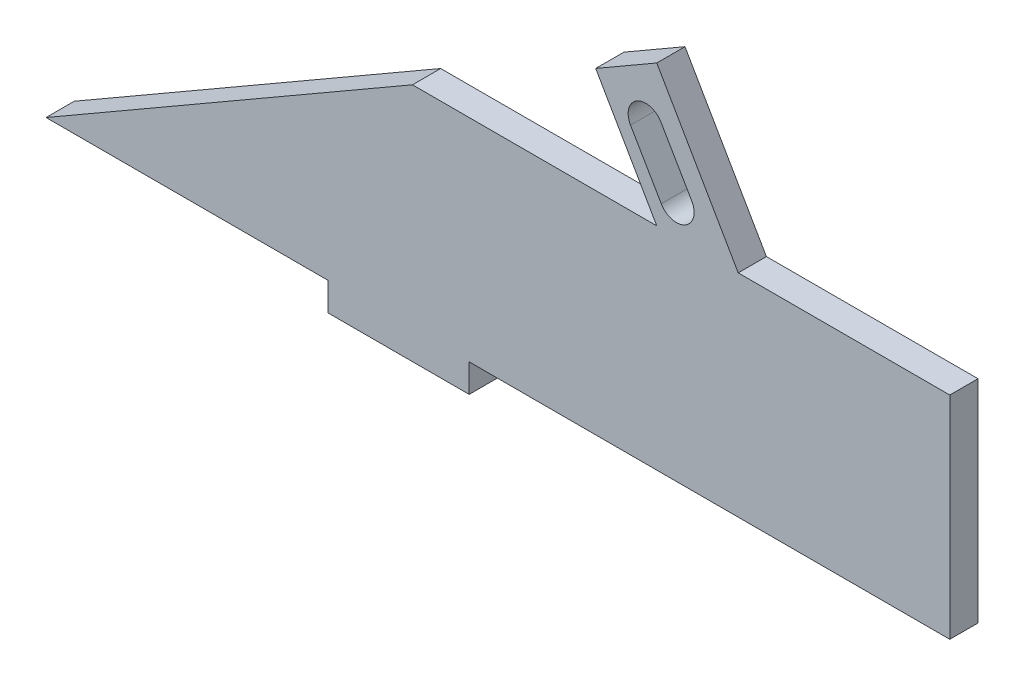
from build123d import *

# Parameters (mm, degrees)
BOSS_EXTRUDE1_DEPTH = 4
CUT_EXTRUDE2_DEPTH  = 4
SKETCH5_W           = 4
SKETCH5_H           = 30
BOSS_EXTRUDE2_DEPTH = 30


with BuildPart() as part:
    # Sketch1 → Boss-Extrude1 (new body)
    with BuildSketch(Plane.XY):
        Polygon((0, 0), (-38.149545772, 0), (-38.149545772, -4), (-58.149545772, -4), (-58.149545772, 0), (-98.149545772, 0), (-46.188021545, 30), (-11.547005384, 30), (-20.207259423, 45.000000002), (-11.547005385, 50.000000002), (0, 30), align=None)
    extrude(amount=BOSS_EXTRUDE1_DEPTH)

    # Sketch3 → Cut-Extrude2 (cut)
    with BuildSketch(Plane.XY.offset(4)):
        with BuildLine():
            Line((-6.593479065, 35.551516575), (-10.950440862, 43.025442617))
            ThreePointArc((-10.950440862, 43.025442617), (-14.369311445, 43.926177837), (-15.270046665, 40.507307254))
            Line((-15.270046665, 40.507307254), (-10.913084868, 33.033381213))
            ThreePointArc((-10.913084868, 33.033381213), (-7.494214285, 32.132645993), (-6.593479065, 35.551516575))
        make_face()
    extrude(amount=-CUT_EXTRUDE2_DEPTH, mode=Mode.SUBTRACT)

    # Sketch5 → Boss-Extrude2 (add)
    with BuildSketch(Plane(origin=(0, 0, 0), x_dir=(0, 0, -1), z_dir=(1, 0, 0))):
        with Locations((-2, 15)):
            Rectangle(SKETCH5_W, SKETCH5_H)
    extrude(amount=BOSS_EXTRUDE2_DEPTH)


solid = part.part
